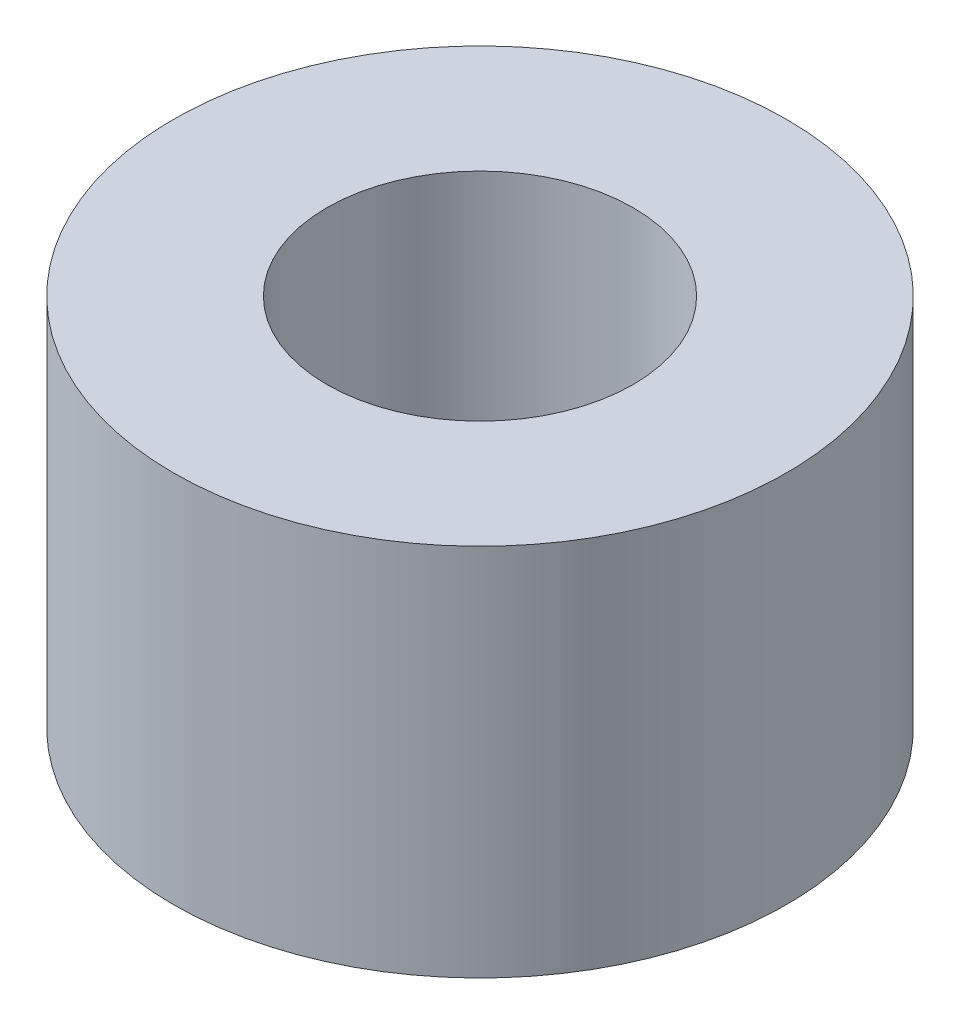
from build123d import *

# Parameters (mm, degrees)
SKETCH1_R           = 25.4
SKETCH1_R_2         = 12.7
BOSS_EXTRUDE1_DEPTH = 31


with BuildPart() as part:
    # Sketch1 → Boss-Extrude1 (new body)
    with BuildSketch(Plane(origin=(0, 0, 0), x_dir=(1, 0, 0), z_dir=(0, 1, 0))):
        with Locations(Location((0, 0, 0), (0, 0, 270))):
            Circle(SKETCH1_R)
        with Locations(Location((0, 0, 0), (0, 0, 270))):
            Circle(SKETCH1_R_2, mode=Mode.SUBTRACT)
    extrude(amount=BOSS_EXTRUDE1_DEPTH)


solid = part.part
